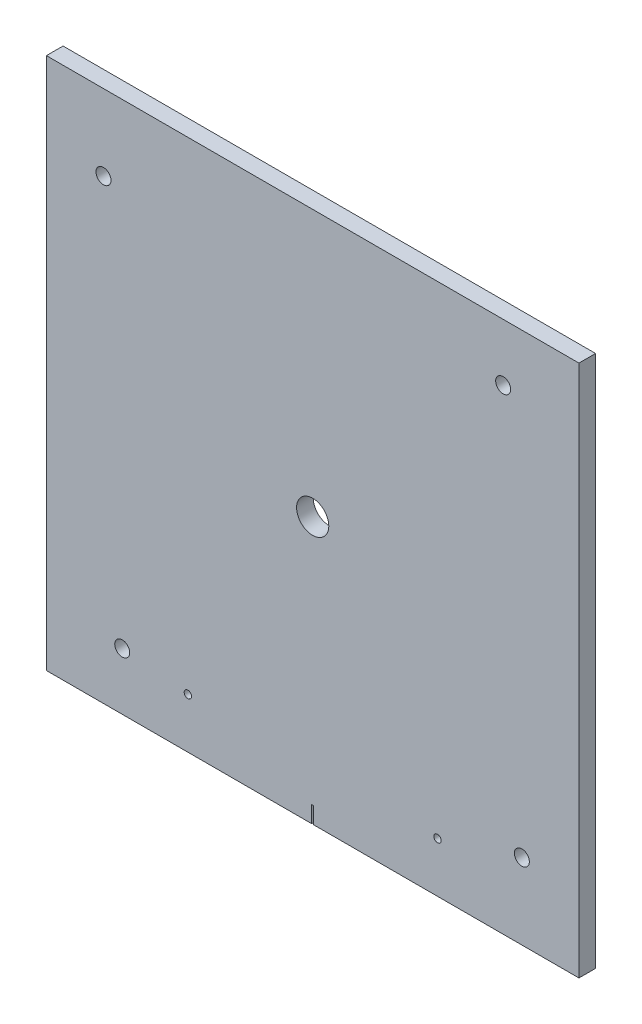
from build123d import *

# Parameters (mm, degrees)
SKETCH1_W      = 203.2
SKETCH1_H      = 203.2
EXTRUDE1_DEPTH = 6.35
SKETCH2_R      = 6.1468
EXTRUDE2_DEPTH = 144.824345992
SKETCH3_R      = 1.4097
EXTRUDE3_DEPTH = 144.824345992
SKETCH4_W      = 0.79375
SKETCH4_H      = 6.35
EXTRUDE4_DEPTH = 6.35
SKETCH5_R      = 2.8575
EXTRUDE5_DEPTH = 144.824345992


with BuildPart() as part:
    # Sketch1 → Extrude1 (new body)
    with BuildSketch(Plane.XY):
        Rectangle(SKETCH1_W, SKETCH1_H)
    extrude(amount=EXTRUDE1_DEPTH)

    # Sketch2 → Extrude2 (cut, through all)
    with BuildSketch(Plane.XY.offset(6.35)):
        Circle(SKETCH2_R)
    extrude(amount=-EXTRUDE2_DEPTH, mode=Mode.SUBTRACT)

    # Sketch3 → Extrude3 (cut, through all)
    with BuildSketch(Plane.XY.offset(6.35)):
        with Locations((-47.625, -82.48891971)):
            Circle(SKETCH3_R)
        with Locations((47.625, -82.48891971)):
            Circle(SKETCH3_R)
    extrude(amount=-EXTRUDE3_DEPTH, mode=Mode.SUBTRACT)

    # Sketch4 → Extrude4 (cut)
    with BuildSketch(Plane.XY.offset(6.35)):
        with Locations((0, -98.425)):
            Rectangle(SKETCH4_W, SKETCH4_H)
    extrude(amount=-EXTRUDE4_DEPTH, mode=Mode.SUBTRACT)

    # Sketch5 → Extrude5 (cut, through all)
    with BuildSketch(Plane.XY.offset(6.35)):
        with Locations((-79.82293888, 72.673935689)):
            Circle(SKETCH5_R)
        with Locations((72.673935689, 79.82293888)):
            Circle(SKETCH5_R)
        with Locations((-72.673935689, -79.82293888)):
            Circle(SKETCH5_R)
        with Locations((79.82293888, -72.673935689)):
            Circle(SKETCH5_R)
    extrude(amount=-EXTRUDE5_DEPTH, mode=Mode.SUBTRACT)


solid = part.part
